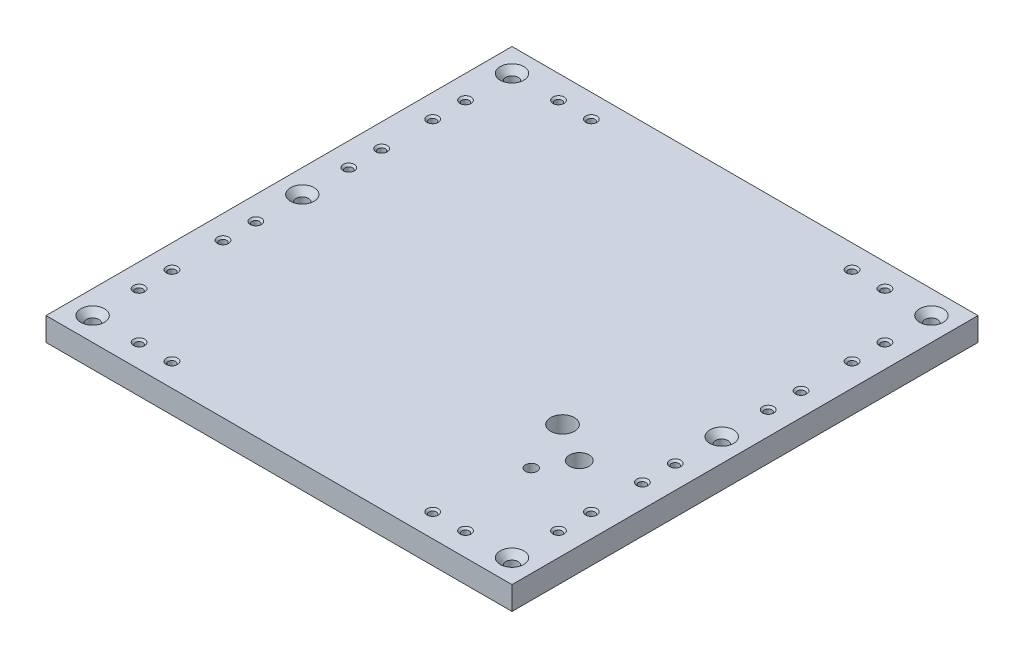
from build123d import *

# Parameters (mm, degrees)
SKETCH1_W                                        = 254
SKETCH1_H                                        = 254
BOSS_EXTRUDE1_DEPTH                              = 12.7
SKETCH2_W                                        = 203.2
SKETCH2_H                                        = 114.3
CUT_EXTRUDE1_DEPTH                               = 181.05357536
SKETCH11_W                                       = 203.2
SKETCH11_H                                       = 114.3
BOSS_EXTRUDE2_DEPTH                              = 12.7
SKETCH13_R                                       = 5.3578125
SKETCH13_R_2                                     = 6.4897
CUT_EXTRUDE8_DEPTH                               = 181.05357536
SKETCH14_R                                       = 3.1623
CUT_EXTRUDE9_DEPTH                               = 181.05357536
F_10_32_TAPPED_HOLE2_D                           = 4.0386
F_10_32_TAPPED_HOLE2_CSINK_D                     = 6.096
F_10_32_TAPPED_HOLE2_CSINK_ANGLE                 = 90
MIRROR2_COPY_1_D                                 = 4.0386
MIRROR2_COPY_1_CSINK_D                           = 6.096
MIRROR2_COPY_1_CSINK_ANGLE                       = 90
CSK_FOR_1_4_FLAT_HEAD_MACHINE_SCREW1_D           = 6.7564
CSK_FOR_1_4_FLAT_HEAD_MACHINE_SCREW1_CSINK_D     = 12.8778
CSK_FOR_1_4_FLAT_HEAD_MACHINE_SCREW1_CSINK_ANGLE = 82


with BuildPart() as part:
    # Sketch1 → Boss-Extrude1 (new body)
    with BuildSketch(Plane(origin=(0, 0, 0), x_dir=(1, 0, 0), z_dir=(0, 1, 0))):
        Rectangle(SKETCH1_W, SKETCH1_H)
    extrude(amount=BOSS_EXTRUDE1_DEPTH)

    # Sketch2 → Cut-Extrude1 (cut, through all)
    with BuildSketch(Plane(origin=(0, 12.7, 0), x_dir=(1, 0, 0), z_dir=(0, 1, 0))):
        with Locations((0, -69.85)):
            Rectangle(SKETCH2_W, SKETCH2_H)
        with Locations((0, 69.85)):
            Rectangle(SKETCH2_W, SKETCH2_H)
    extrude(amount=-CUT_EXTRUDE1_DEPTH, mode=Mode.SUBTRACT)

    # Sketch11 → Boss-Extrude2 (add)
    with BuildSketch(Plane(origin=(0, 12.7, 0), x_dir=(1, 0, 0), z_dir=(0, 1, 0))):
        with Locations((0, 69.85)):
            Rectangle(SKETCH11_W, SKETCH11_H)
        with Locations((0, -69.85)):
            Rectangle(SKETCH11_W, SKETCH11_H)
    extrude(amount=-BOSS_EXTRUDE2_DEPTH)

    # Sketch13 → Cut-Extrude8 (cut, through all)
    with BuildSketch(Plane(origin=(0, 12.7, 0), x_dir=(1, 0, 0), z_dir=(0, 1, 0))):
        with Locations(Location((86.819046868, -50.12500008, 0), (0, 0, 270))):
            Circle(SKETCH13_R)
        with Locations(Location((65.16841174, -37.625000061, 0), (0, 0, 270))):
            Circle(SKETCH13_R_2)
    extrude(amount=-CUT_EXTRUDE8_DEPTH, mode=Mode.SUBTRACT)

    # Sketch14 → Cut-Extrude9 (cut, through all)
    with BuildSketch(Plane(origin=(0, 12.7, 0), x_dir=(1, 0, 0), z_dir=(0, 1, 0))):
        with Locations(Location((77.237896866, -66.720038678, 0), (0, 0, 270))):
            Circle(SKETCH14_R)
    extrude(amount=-CUT_EXTRUDE9_DEPTH, mode=Mode.SUBTRACT)

    # #10-32 Tapped Hole2 (through all)
    with Locations(Plane(origin=(0, 12.7, 0), x_dir=(1, 0, 0), z_dir=(0, 1, 0))):
        with Locations((-114.3, -25.3365), (-114.3, -43.2435), (-114.3, -71.0565), (-114.3, -88.9635), (-88.9635, -114.3), (-71.0565, -114.3)):
            f_10_32_tapped_hole2 = CounterSinkHole(F_10_32_TAPPED_HOLE2_D / 2, F_10_32_TAPPED_HOLE2_CSINK_D / 2, counter_sink_angle=F_10_32_TAPPED_HOLE2_CSINK_ANGLE)

    # Mirror1: #10-32 Tapped Hole2 across plane
    add(f_10_32_tapped_hole2.mirror(Plane.XY), mode=Mode.SUBTRACT)

    # Mirror2: #10-32 Tapped Hole2 across plane
    add(f_10_32_tapped_hole2.mirror(Plane(origin=(0, 0, 0), x_dir=(0, 0, 1), z_dir=(1, 0, 0))), mode=Mode.SUBTRACT)

    # Mirror2 copy 1 (through all)
    with Locations(Plane(origin=(0, 12.7, 0), x_dir=(-1, 0, 0), z_dir=(0, 1, 0))):
        with Locations((-114.3, -25.3365), (-114.3, -43.2435), (-114.3, -71.0565), (-114.3, -88.9635), (-88.9635, -114.3), (-71.0565, -114.3)):
            CounterSinkHole(MIRROR2_COPY_1_D / 2, MIRROR2_COPY_1_CSINK_D / 2, counter_sink_angle=MIRROR2_COPY_1_CSINK_ANGLE)

    # CSK for 1/4 Flat Head Machine Screw1 (through all)
    with Locations(Plane(origin=(0, 12.7, 0), x_dir=(1, 0, 0), z_dir=(0, 1, 0))):
        with Locations((-114.3, 0), (-114.3, 114.3), (-114.3, -114.3)):
            csk_for_1_4_flat_head_machine_screw1 = CounterSinkHole(CSK_FOR_1_4_FLAT_HEAD_MACHINE_SCREW1_D / 2, CSK_FOR_1_4_FLAT_HEAD_MACHINE_SCREW1_CSINK_D / 2, counter_sink_angle=CSK_FOR_1_4_FLAT_HEAD_MACHINE_SCREW1_CSINK_ANGLE)

    # Mirror3: CSK for 1/4 Flat Head Machine Screw1 across plane
    add(csk_for_1_4_flat_head_machine_screw1.mirror(Plane(origin=(0, 0, 0), x_dir=(0, 0, 1), z_dir=(1, 0, 0))), mode=Mode.SUBTRACT)


solid = part.part
